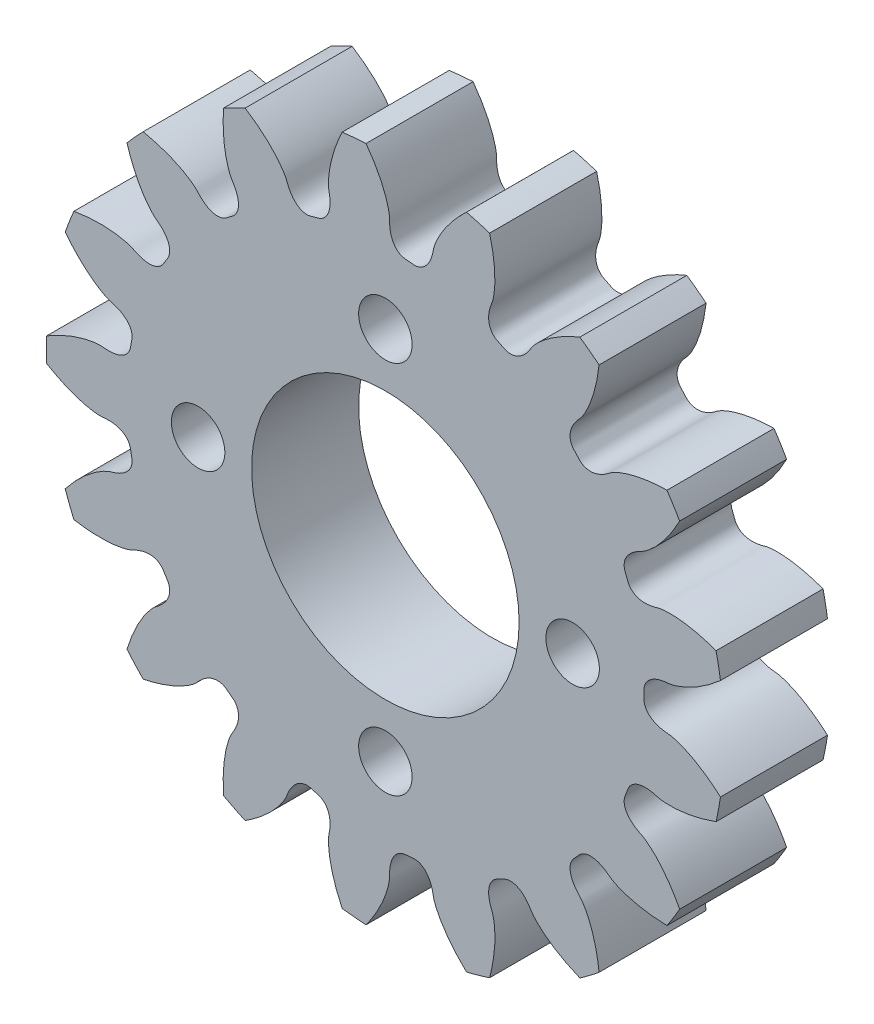
from build123d import *

# Parameters (mm, degrees)
SKETCH_371_W               = 6
SKETCH_371_H               = 18.999999715
CUT_EXTRUDE_566_DEPTH      = 3
PATTERN_CIRCULAR_618_COUNT = 17
SKETCH_665_W               = 6
SKETCH_665_H               = 7.5
SKETCH_1_R                 = 1.5
CUT_EXTRUDE_1_DEPTH        = 28.51057187


with BuildPart() as part:
    # Sketch 371 → Revolve 398 (revolve)
    with BuildSketch(Plane(origin=(0, 0, 0), x_dir=(0, 0, -1), z_dir=(1, 0, 0))):
        with Locations((0, 9.499999858)):
            Rectangle(SKETCH_371_W, SKETCH_371_H)
    revolve(axis=Axis((0, 0, 0), (0, 0, -1)))

    # Sketch 441 → Cut-Extrude 566 (cut, symmetric)
    with BuildSketch(Plane.XY):
        with BuildLine():
            ThreePointArc((18.877658909, 2.905853259), (19.099999713, 0), (18.877658909, -2.905853259))
            add(Edge.make_bspline(
                [(18.877658909, -2.905853259), (18.716157077, -2.760491903), (18.473674685, -2.555466773), (18.146231854, -2.305800395), (17.915616582, -2.141617068), (17.694045744, -1.994557675), (17.482378444, -1.863843394), (17.281432145, -1.748657621), (17.091981124, -1.648148349), (16.91475505, -1.561430027), (16.75043763, -1.487585558), (16.599665344, -1.425668538), (16.463026276, -1.374704812), (16.341059011, -1.333696439), (16.234251655, -1.301618374), (16.143040872, -1.277437356), (16.067811224, -1.260066189), (16.008893984, -1.248498433), (15.908190545, -1.231787486), (15.807316828, -1.229114573), (15.703657001, -1.215951521), (15.649467568, -1.208331777), (15.596258759, -1.199646448), (15.544003852, -1.190006775), (15.492690854, -1.17937343), (15.442301512, -1.167741383), (15.392816806, -1.155090622), (15.344215565, -1.141398119), (15.296474978, -1.126633588), (15.249570732, -1.110759317), (15.203477429, -1.093728751), (15.158169165, -1.075485196), (15.113620398, -1.05596029), (15.069807181, -1.035072325), (15.026708876, -1.012724457), (14.984310506, -0.988802839), (14.942605916, -0.963174827), (14.901601952, -0.935687429), (14.861323874, -0.906166316), (14.821822218, -0.874415841), (14.78318124, -0.840220712), (14.745528928, -0.803350183), (14.709048241, -0.76356583), (14.67398879, -0.720634147), (14.640677395, -0.674345103), (14.609525194, -0.624537363), (14.581027601, -0.571129886), (14.555754764, -0.514157513), (14.534322936, -0.45380698), (14.517368695, -0.390442448), (14.50543648, -0.324626756), (14.499650458, -0.262572046), (14.497192375, -0.154189358), (14.502240728, 0), (14.497192375, 0.154189358), (14.499650458, 0.262572046), (14.50543648, 0.324626756), (14.517368695, 0.390442448), (14.534322936, 0.45380698), (14.555754764, 0.514157513), (14.581027601, 0.571129886), (14.609525194, 0.624537363), (14.640677395, 0.674345103), (14.67398879, 0.720634147), (14.709048241, 0.76356583), (14.745528928, 0.803350183), (14.78318124, 0.840220712), (14.821822218, 0.874415841), (14.861323874, 0.906166316), (14.901601952, 0.935687429), (14.942605916, 0.963174827), (14.984310506, 0.988802839), (15.026708876, 1.012724457), (15.069807181, 1.035072325), (15.113620398, 1.05596029), (15.158169165, 1.075485196), (15.203477429, 1.093728751), (15.249570732, 1.110759317), (15.296474978, 1.126633588), (15.344215565, 1.141398119), (15.392816806, 1.155090622), (15.442301512, 1.167741383), (15.492690854, 1.17937343), (15.544003852, 1.190006775), (15.596258759, 1.199646448), (15.649467568, 1.208331777), (15.703657001, 1.215951521), (15.807316828, 1.229114573), (15.908190545, 1.231787486), (16.008893984, 1.248498433), (16.067811224, 1.260066189), (16.143040872, 1.277437356), (16.234251655, 1.301618374), (16.341059011, 1.333696439), (16.463026276, 1.374704812), (16.599665344, 1.425668538), (16.75043763, 1.487585558), (16.91475505, 1.561430027), (17.091981124, 1.648148349), (17.281432145, 1.748657621), (17.482378444, 1.863843394), (17.694045744, 1.994557675), (17.915616582, 2.141617068), (18.146231854, 2.305800395), (18.473674685, 2.555466773), (18.716157077, 2.760491903), (18.877658909, 2.905853259)],
                knots=[0, 0, 0, 0, 0.058344307, 0.085213395, 0.110547108, 0.134345443, 0.156608403, 0.177335985, 0.196528192, 0.214185022, 0.230306475, 0.244892552, 0.257943253, 0.269458577, 0.279438525, 0.287883097, 0.294792293, 0.300166112, 0.304004555, 0.322189706, 0.327162426, 0.332059271, 0.336883274, 0.34163777, 0.346326431, 0.350953304, 0.355522857, 0.360040026, 0.364510274, 0.368939642, 0.373334824, 0.377703228, 0.382053055, 0.38639337, 0.390734176, 0.395086475, 0.399462319, 0.403874831, 0.408338175, 0.412867469, 0.417478596, 0.42218788, 0.4270116, 0.431965278, 0.437062734, 0.442314886, 0.447728346, 0.453303917, 0.459035192, 0.46490754, 0.470897788, 0.47697488, 0.481620748, 0.5, 0.518379252, 0.52302512, 0.529102212, 0.53509246, 0.540964808, 0.546696083, 0.552271654, 0.557685114, 0.562937266, 0.568034722, 0.5729884, 0.57781212, 0.582521404, 0.587132531, 0.591661825, 0.596125169, 0.600537681, 0.604913525, 0.609265824, 0.61360663, 0.617946945, 0.622296772, 0.626665176, 0.631060358, 0.635489726, 0.639959974, 0.644477143, 0.649046696, 0.653673569, 0.65836223, 0.663116726, 0.667940729, 0.672837574, 0.677810294, 0.695995445, 0.699833888, 0.705207707, 0.712116903, 0.720561475, 0.730541423, 0.742056747, 0.755107448, 0.769693525, 0.785814978, 0.803471808, 0.822664015, 0.843391597, 0.865654557, 0.889452892, 0.914786605, 0.941655693, 1, 1, 1, 1], degree=3))
        make_face()
    cut_extrude_566 = extrude(amount=CUT_EXTRUDE_566_DEPTH, both=True, mode=Mode.SUBTRACT)

    # Pattern Circular 618: Cut-Extrude 566 ×17 about axis
    pattern_circular_618_axis = Axis((0, 0, 55), (0, 0, -1))
    for i in range(1, PATTERN_CIRCULAR_618_COUNT):
        add(cut_extrude_566.rotate(pattern_circular_618_axis, i * 360 / PATTERN_CIRCULAR_618_COUNT), mode=Mode.SUBTRACT)

    # Sketch 665 → Cut-Revolve 758 (revolve, cut)
    with BuildSketch(Plane(origin=(0, 0, 0), x_dir=(0, 0, -1), z_dir=(1, 0, 0))):
        with Locations((0, 3.75)):
            Rectangle(SKETCH_665_W, SKETCH_665_H)
    revolve(axis=Axis((0, 0, 0), (0, 0, -1)), mode=Mode.SUBTRACT)

    # 草图1 → 切除-拉伸1 (cut, through all)
    with BuildSketch(Plane(origin=(0, 0, -3), x_dir=(-1, 0, 0), z_dir=(0, 0, -1))):
        with Locations((0, 10.5)):
            Circle(SKETCH_1_R)
        with Locations((10.5, 0)):
            Circle(SKETCH_1_R)
        with Locations((0, -10.5)):
            Circle(SKETCH_1_R)
        with Locations((-10.5, 0)):
            Circle(SKETCH_1_R)
    extrude(amount=-CUT_EXTRUDE_1_DEPTH, mode=Mode.SUBTRACT)


solid = part.part
